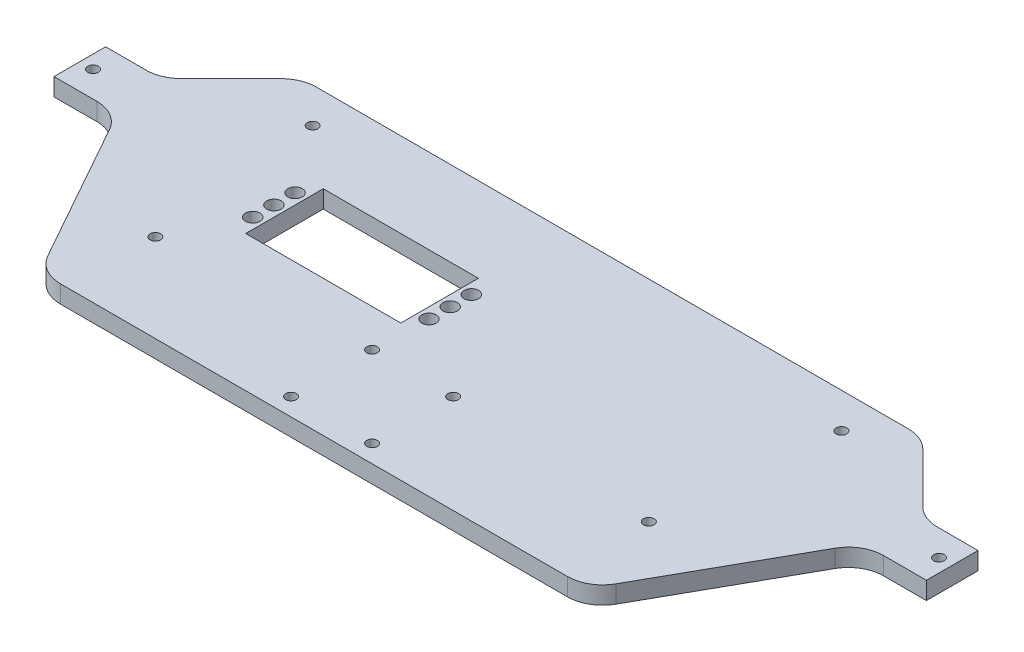
from build123d import *

# Parameters (mm, degrees)
SALIENTE_EXTRUIR1_DEPTH = 5
REDONDEO1_R             = 10
CROQUIS2_R              = 1.5
CROQUIS2_R_2            = 2.05
CROQUIS2_W              = 42
CROQUIS2_H              = 20
CORTAR_EXTRUIR1_DEPTH   = 135.669558943
CROQUIS3_W              = 4
CROQUIS3_H              = 14.636342218
CORTAR_EXTRUIR2_DEPTH   = 135.669558943
CROQUIS4_W              = 44
CROQUIS4_H              = 22
CORTAR_EXTRUIR3_DEPTH   = 131.881206084


with BuildPart() as part:
    # Croquis1 → Saliente-Extruir1 (new body)
    with BuildSketch(Plane(origin=(0, 0, 0), x_dir=(1, 0, 0), z_dir=(0, 1, 0))):
        Polygon((-88.1, 42.318171109), (88.1, 42.318171109), (108.1, 22.318171109), (127.75, 22.318171109), (127.75, 7.681828891), (105.75, 7.681828891), (77.75, -42.318171109), (-77.75, -42.318171109), (-105.75, 7.681828891), (-127.75, 7.681828891), (-127.75, 22.318171109), (-108.1, 22.318171109), align=None)
    extrude(amount=SALIENTE_EXTRUIR1_DEPTH)

    # Redondeo1
    redondeo1_edges = [part.edges().sort_by_distance(p)[0] for p in [
        (-88.1, 2.5, -42.318171109),
        (88.1, 2.5, -42.318171109),
        (108.1, 2.5, -22.318171109),
        (105.75, 2.5, -7.681828891),
        (77.75, 2.5, 42.318171109),
        (-77.75, 2.5, 42.318171109),
        (-105.75, 2.5, -7.681828891),
        (-108.1, 2.5, -22.318171109),
    ]]
    fillet(redondeo1_edges, radius=REDONDEO1_R)

    # Croquis2 → Cortar-Extruir1 (cut, through all)
    with BuildSketch(Plane(origin=(0, 5, 0), x_dir=(1, 0, 0), z_dir=(0, 1, 0))):
        with Locations(Location((70, -17.318171109, 0), (0, 0, 270))):
            Circle(CROQUIS2_R)
        with Locations(Location((-70, -17.318171109, 0), (0, 0, 270))):
            Circle(CROQUIS2_R)
        with Locations(Location((-119.996067812, 15, 0), (0, 0, 270))):
            Circle(CROQUIS2_R)
        with Locations(Location((119.996067812, 15, 0), (0, 0, 270))):
            Circle(CROQUIS2_R)
        with Locations(Location((-75, 32.318171109, 0), (0, 0, 270))):
            Circle(CROQUIS2_R)
        with Locations(Location((75, 32.318171109, 0), (0, 0, 270))):
            Circle(CROQUIS2_R)
        with Locations(Location((-11.5, -14.318171109, 0), (0, 0, 270))):
            Circle(CROQUIS2_R)
        with Locations(Location((11.5, -14.318171109, 0), (0, 0, 270))):
            Circle(CROQUIS2_R)
        with Locations(Location((-11.5, -37.318171109, 0), (0, 0, 270))):
            Circle(CROQUIS2_R)
        with Locations(Location((11.5, -37.318171109, 0), (0, 0, 270))):
            Circle(CROQUIS2_R)
        with Locations(Location((-61, 7.318171109, 0), (0, 0, 270))):
            Circle(CROQUIS2_R_2)
        with Locations(Location((-11, 7.318171109, 0), (0, 0, 270))):
            Circle(CROQUIS2_R_2)
        with Locations(Location((-61, 13.318171109, 0), (0, 0, 270))):
            Circle(CROQUIS2_R_2)
        with Locations(Location((-61, 1.318171109, 0), (0, 0, 270))):
            Circle(CROQUIS2_R_2)
        with Locations(Location((-11, 13.318171109, 0), (0, 0, 270))):
            Circle(CROQUIS2_R_2)
        with Locations(Location((-11, 1.318171109, 0), (0, 0, 270))):
            Circle(CROQUIS2_R_2)
        with Locations((-36, 7.318171109)):
            Rectangle(CROQUIS2_W, CROQUIS2_H)
    extrude(amount=-CORTAR_EXTRUIR1_DEPTH, mode=Mode.SUBTRACT)

    # Croquis3 → Cortar-Extruir2 (cut, through all)
    with BuildSketch(Plane(origin=(0, 5, 0), x_dir=(1, 0, 0), z_dir=(0, 1, 0))):
        with Locations((-125.75, 15)):
            Rectangle(CROQUIS3_W, CROQUIS3_H)
        with Locations((125.75, 15)):
            Rectangle(CROQUIS3_W, CROQUIS3_H)
    extrude(amount=-CORTAR_EXTRUIR2_DEPTH, mode=Mode.SUBTRACT)

    # Croquis4 → Cortar-Extruir3 (cut, through all)
    with BuildSketch(Plane(origin=(0, 5, 0), x_dir=(1, 0, 0), z_dir=(0, 1, 0))):
        with Locations((-36, 7.318171109)):
            Rectangle(CROQUIS4_W, CROQUIS4_H)
    extrude(amount=-CORTAR_EXTRUIR3_DEPTH, mode=Mode.SUBTRACT)


solid = part.part
